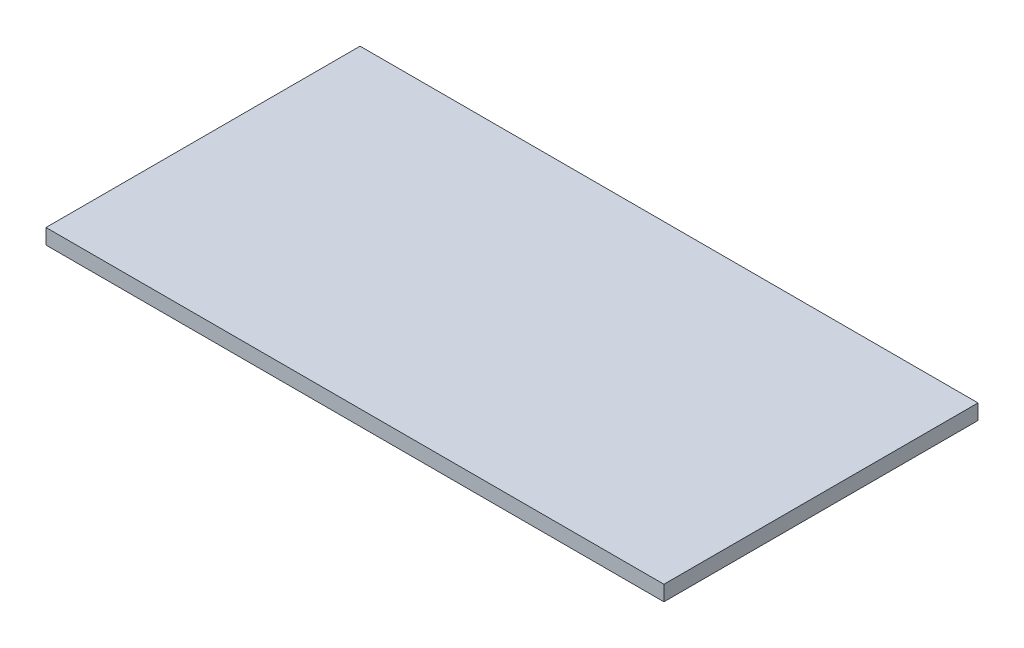
from build123d import *

# Parameters (mm, degrees)
SKETCH1_W           = 205.8
SKETCH1_H           = 104.6
BOSS_EXTRUDE1_DEPTH = 5.08


with BuildPart() as part:
    # Sketch1 → Boss-Extrude1 (new body)
    with BuildSketch(Plane(origin=(0, 0, 0), x_dir=(1, 0, 0), z_dir=(0, 1, 0))):
        with Locations((102.9, 52.3)):
            Rectangle(SKETCH1_W, SKETCH1_H)
    extrude(amount=BOSS_EXTRUDE1_DEPTH)


solid = part.part
